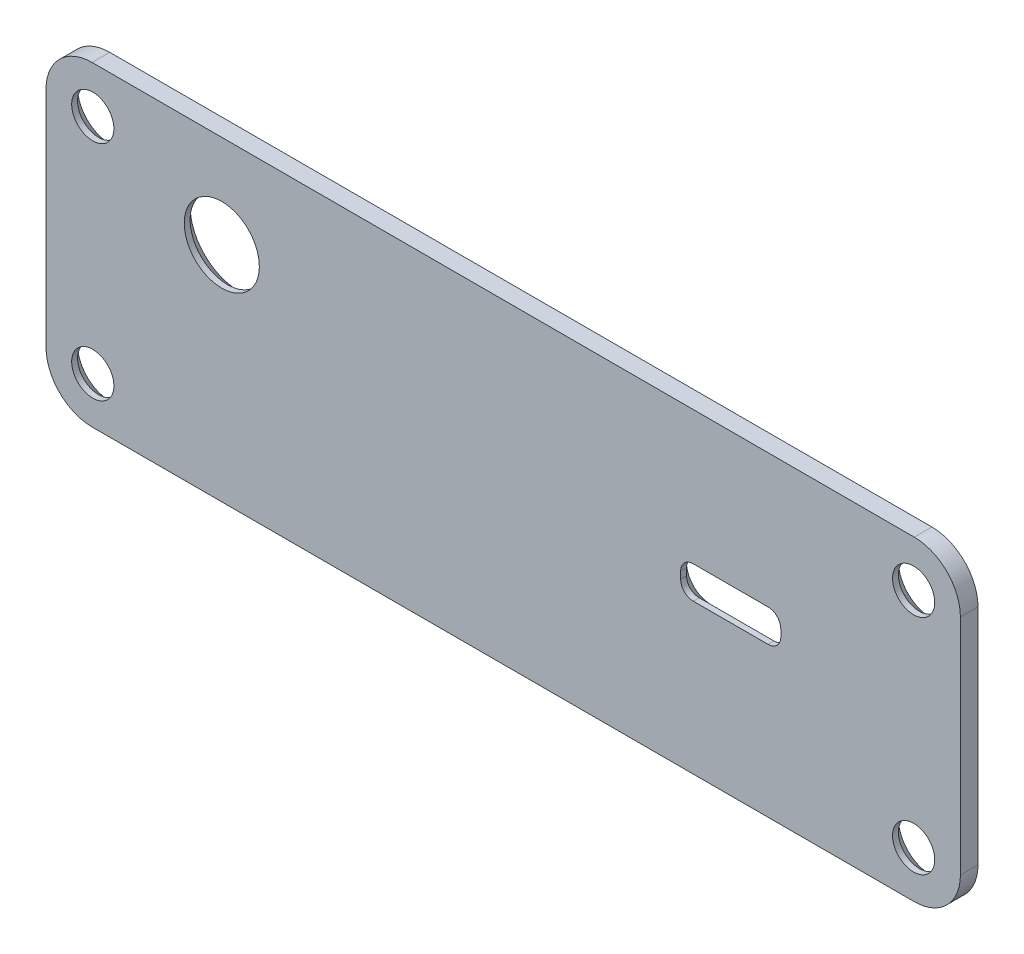
from build123d import *

# Parameters (mm, degrees)
SKETCH2_R           = 1.8
BOSS_EXTRUDE2_DEPTH = 1.5
CUT_EXTRUDE1_DEPTH  = 10
CHAMFER1_SIZE       = 1


with BuildPart() as part:
    # Sketch2 → Boss-Extrude2 (new body)
    with BuildSketch(Plane.XY):
        with BuildLine():
            Line((0, 22.989), (0, 3.935))
            ThreePointArc((0, 3.935), (1.152534816, 1.152534816), (3.935, 0))
            Line((3.935, 0), (74.043, 0))
            ThreePointArc((74.043, 0), (76.825465184, 1.152534816), (77.978, 3.935))
            Line((77.978, 3.935), (77.978, 22.989))
            ThreePointArc((77.978, 22.989), (76.825465184, 25.771465184), (74.043, 26.924))
            Line((74.043, 26.924), (3.935, 26.924))
            ThreePointArc((3.935, 26.924), (1.152534816, 25.771465184), (0, 22.989))
        make_face()
        with Locations((3.989, 22.962)):
            Circle(SKETCH2_R, mode=Mode.SUBTRACT)
        with Locations((73.989, 22.962)):
            Circle(SKETCH2_R, mode=Mode.SUBTRACT)
        with Locations((3.989, 3.962)):
            Circle(SKETCH2_R, mode=Mode.SUBTRACT)
        with Locations((73.989, 3.962)):
            Circle(SKETCH2_R, mode=Mode.SUBTRACT)
    extrude(amount=BOSS_EXTRUDE2_DEPTH)

    # Sketch3 → Cut-Extrude1 (cut)
    with BuildSketch(Plane.XY.offset(1.5)):
        with BuildLine():
            Line((61.57999735, 12.771800059), (58.644998169, 12.771800026))
            Line((58.644998169, 12.771800026), (58.634998169, 12.771800014))
            Line((58.634998169, 12.771800014), (55.199998162, 12.771800021))
            add(Edge.make_bspline(
                [(54.119998217, 13.851800515), (54.119997867, 13.219150926), (54.567348573, 12.771800004), (55.199998162, 12.771800021)],
                knots=[0, 0, 0, 0, 1, 1, 1, 1], degree=3, weights=[1, 0.804737743, 0.804737743, 1]))
            Line((54.119998217, 13.851800515), (54.119998217, 14.451800325))
            add(Edge.make_bspline(
                [(55.199999672, 15.531799951), (54.567349772, 15.53180088), (54.119998359, 15.084450225), (54.119998217, 14.451800325)],
                knots=[0, 0, 0, 0, 1, 1, 1, 1], degree=3, weights=[1, 0.804737597, 0.804737597, 1]))
            Line((55.199999672, 15.531799951), (61.579997316, 15.531799924))
            add(Edge.make_bspline(
                [(61.579997316, 15.531799924), (62.212646994, 15.531800299), (62.659998028, 15.084449578), (62.659998093, 14.451799899)],
                knots=[0, 0, 0, 0, 1, 1, 1, 1], degree=3, weights=[1, 0.804737646, 0.804737646, 1]))
            Line((62.659998093, 14.451799899), (62.659998093, 13.851800373))
            add(Edge.make_bspline(
                [(62.659998093, 13.851800373), (62.659998187, 13.219150584), (62.212647139, 12.77179972), (61.57999735, 12.771800059)],
                knots=[0, 0, 0, 0, 1, 1, 1, 1], degree=3, weights=[1, 0.804737594, 0.804737594, 1]))
        make_face()
        with BuildLine():
            add(Edge.make_bspline(
                [(11.789964969, 18.984498524), (11.789964969, 12.584498524), (18.189964969, 12.584498524), (18.189964969, 18.984498524)],
                knots=[0, 0, 0, 0, 1, 1, 1, 1], degree=3, weights=[1, 0.333333333, 0.333333333, 1]))
            add(Edge.make_bspline(
                [(18.189964969, 18.984498524), (18.189964969, 25.384498524), (11.789964969, 25.384498524), (11.789964969, 18.984498524)],
                knots=[0, 0, 0, 0, 1, 1, 1, 1], degree=3, weights=[1, 0.333333333, 0.333333333, 1]))
        make_face()
    extrude(amount=-CUT_EXTRUDE1_DEPTH, mode=Mode.SUBTRACT)

    # Chamfer1
    chamfer1_edges = [part.edges().sort_by_distance(p)[0] for p in [
        (2.189, 22.962, 0),
        (72.189, 22.962, 0),
        (2.189, 3.962, 0),
        (72.189, 3.962, 0),
        (54.119998217, 14.15180042, 0),
        (54.436322668, 13.088124864, 0),
        (56.917498165, 12.771800017, 0),
        (62.343673211, 13.088124639, 0),
        (62.659998093, 14.151800136, 0),
        (62.343673104, 15.215475466, 0),
        (58.389998494, 15.531799938, 0),
        (54.436323499, 15.215475963, 0),
        (14.989964969, 22.184498524, 0),
    ]]
    chamfer(chamfer1_edges, length=CHAMFER1_SIZE)


solid = part.part
